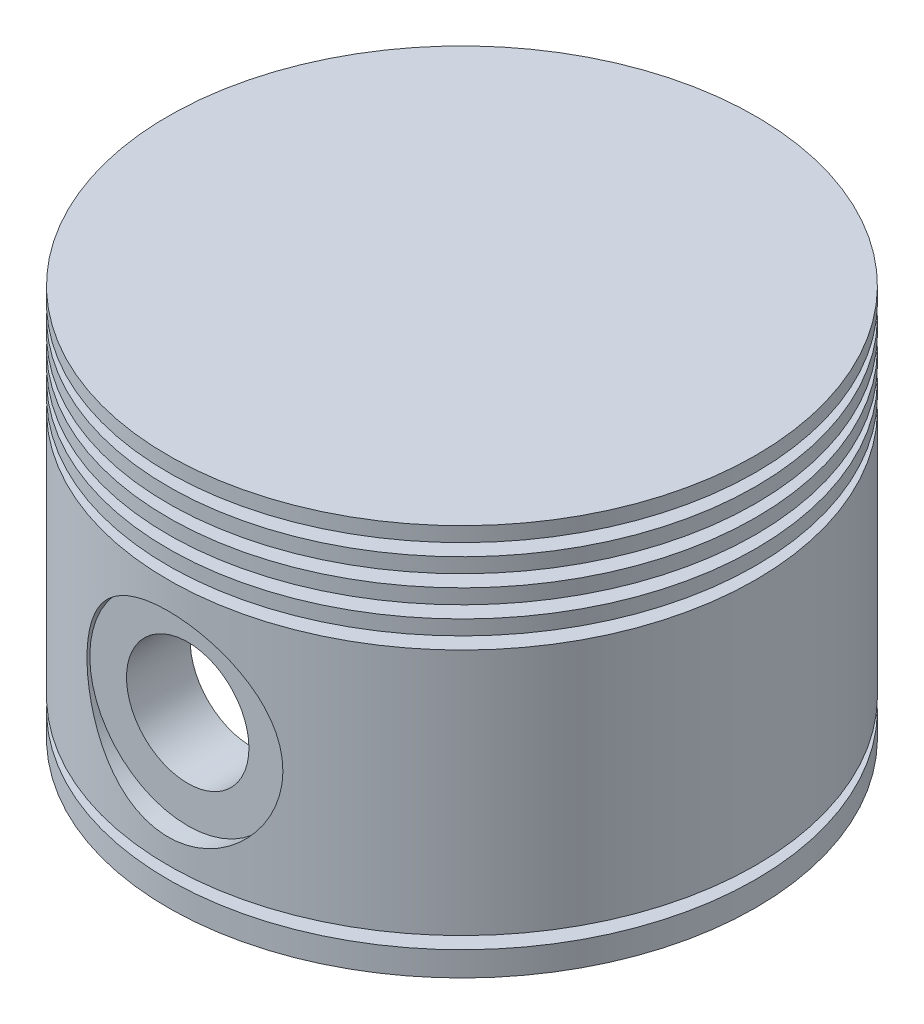
from build123d import *

# Parameters (mm, degrees)
SKETCH2_R               = 25
CUT_EXTRUDE1_DEPTH      = 35
SKETCH3_R               = 10
SKETCH3_R_2             = 6.25
CUT_EXTRUDE2_DEPTH      = 2
CUT_EXTRUDE3_REACH      = 80.102
CUT_EXTRUDE3_END_RADIUS = 25
SKETCH3_2_R             = 6.25
BOSS_EXTRUDE1_START     = -2
SKETCH3_3_R             = 10
SKETCH3_3_R_2           = 6.25
BOSS_EXTRUDE1_DEPTH     = 6.5
BOSS_EXTRUDE2_START     = -51.5
SKETCH3_4_R             = 10
SKETCH3_4_R_2           = 6.25
BOSS_EXTRUDE2_DEPTH     = 6.5


with BuildPart() as part:
    # Sketch1 → Revolve1 (revolve)
    with BuildSketch(Plane.XY, mode=Mode.PRIVATE) as revolve1_sk:
        Polygon((-30, 0), (0, 0), (0, 40), (-30, 40), (-30, 38.5), (-28, 38.5), (-28, 37.25), (-30, 37.25), (-30, 35.75), (-28, 35.75), (-28, 34.5), (-30, 34.5), (-30, 33), (-28, 33), (-28, 31.75), (-30, 31.75), (-30, 30.25), (-28, 30.25), (-28, 29), (-30, 29), (-30, 3.75), (-28, 3.75), (-28, 2.5), (-30, 2.5), align=None)
    revolve(revolve1_sk.sketch.rotate(Axis((0, 0, 0), (0, 1, 0)), 180), axis=Axis((0, 0, 0), (0, 1, 0)))

    # Sketch2 → Cut-Extrude1 (cut)
    with BuildSketch(Plane.XZ):
        Circle(SKETCH2_R)
    extrude(amount=-CUT_EXTRUDE1_DEPTH, mode=Mode.SUBTRACT)

    # Sketch3 → Cut-Extrude2 (cut)
    with BuildSketch(Plane.XY.offset(30)):
        with Locations((0, 16.25)):
            Circle(SKETCH3_R)
        with Locations((0, 16.25)):
            Circle(SKETCH3_R_2, mode=Mode.SUBTRACT)
    cut_extrude2 = extrude(amount=-CUT_EXTRUDE2_DEPTH, mode=Mode.SUBTRACT)

    # Cut-Extrude3: up to this cylinder (the profile starts outside it)
    cut_extrude3_end = Plane(origin=(0, 16.25, 0), z_dir=(0, -1, 0)) * Cylinder(CUT_EXTRUDE3_END_RADIUS, 211.204, mode=Mode.PRIVATE)
    # Sketch3<2> → Cut-Extrude3 (cut, up to the surface)
    with BuildSketch(Plane.XY.offset(30), mode=Mode.PRIVATE) as cut_extrude3_sk1:
        with Locations((0, 16.25)):
            Circle(SKETCH3_2_R)
    cut_extrude3_tool1 = extrude(cut_extrude3_sk1.sketch, amount=-CUT_EXTRUDE3_REACH, mode=Mode.PRIVATE) - cut_extrude3_end
    cut_extrude3 = cut_extrude3_tool1.solids().sort_by_distance((0, 16.25, 30))[0]
    add(cut_extrude3, mode=Mode.SUBTRACT)

    # Sketch3<3> → Boss-Extrude1 (add)
    with BuildSketch(Plane.XY.offset(30).offset(BOSS_EXTRUDE1_START)):
        with Locations((0, 16.25)):
            Circle(SKETCH3_3_R)
        with Locations((0, 16.25)):
            Circle(SKETCH3_3_R_2, mode=Mode.SUBTRACT)
    extrude(amount=-BOSS_EXTRUDE1_DEPTH)

    # Mirror1: Cut-Extrude2, Cut-Extrude3 across plane
    add(cut_extrude2.mirror(Plane.XY), mode=Mode.SUBTRACT)
    add(cut_extrude3.mirror(Plane.XY), mode=Mode.SUBTRACT)

    # Sketch3<4> → Boss-Extrude2 (add)
    with BuildSketch(Plane.XY.offset(30).offset(BOSS_EXTRUDE2_START)):
        with Locations((0, 16.25)):
            Circle(SKETCH3_4_R)
        with Locations((0, 16.25)):
            Circle(SKETCH3_4_R_2, mode=Mode.SUBTRACT)
    extrude(amount=-BOSS_EXTRUDE2_DEPTH)


solid = part.part
